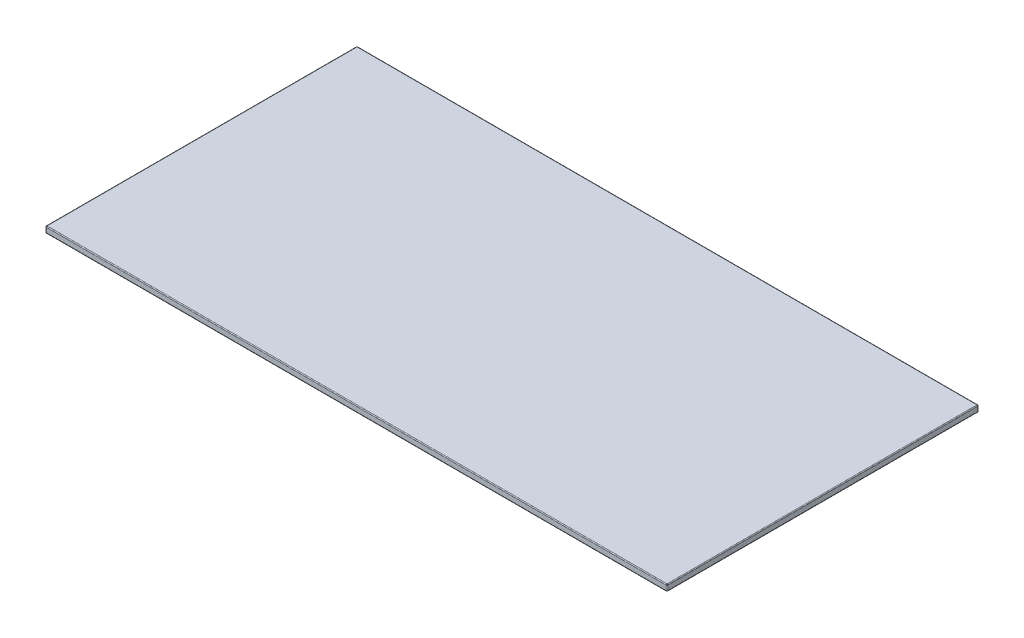
from build123d import *

# Parameters (mm, degrees)
SKETCH1_W           = 2036.7625
SKETCH1_H           = 1020.7625
BOSS_EXTRUDE1_DEPTH = 20.6375
FILLET2_R           = 2.54


with BuildPart() as part:
    # Sketch1 → Boss-Extrude1 (new body)
    with BuildSketch(Plane(origin=(0, 0, 0), x_dir=(1, 0, 0), z_dir=(0, 1, 0))):
        Rectangle(SKETCH1_W, SKETCH1_H)
    extrude(amount=BOSS_EXTRUDE1_DEPTH)

    # Fillet2
    fillet2_edges = [part.edges().sort_by_distance(p)[0] for p in [
        (1018.38125, 20.6375, 0),
        (0, 20.6375, -510.38125),
        (-1018.38125, 20.6375, 0),
        (0, 0, -510.38125),
        (1018.38125, 0, 0),
        (0, 0, 510.38125),
        (-1018.38125, 0, 0),
        (0, 20.6375, 510.38125),
        (-1018.38125, 10.31875, -510.38125),
        (1018.38125, 10.31875, -510.38125),
        (1018.38125, 10.31875, 510.38125),
        (-1018.38125, 10.31875, 510.38125),
    ]]
    fillet(fillet2_edges, radius=FILLET2_R)


solid = part.part
